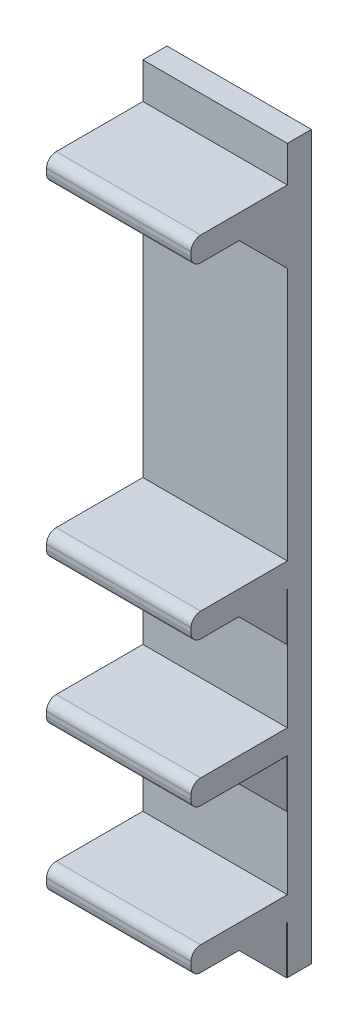
from build123d import *

# Parameters (mm, degrees)
SKETCH1_W           = 19.05
SKETCH1_H           = 95.25
BOSS_EXTRUDE1_DEPTH = 3.175
SKETCH2_W           = 19.05
SKETCH2_H           = 3.175
BOSS_EXTRUDE2_DEPTH = 12.7
BOSS_EXTRUDE3_DEPTH = 19.05
FILLET1_R           = 1.27


with BuildPart() as part:
    # Sketch1 → Boss-Extrude1 (new body)
    with BuildSketch(Plane.XY):
        with Locations((9.525, 47.625)):
            Rectangle(SKETCH1_W, SKETCH1_H)
    extrude(amount=-BOSS_EXTRUDE1_DEPTH)

    # Sketch2 → Boss-Extrude2 (add)
    with BuildSketch(Plane.XY):
        with Locations((9.525, 7.8867)):
            Rectangle(SKETCH2_W, SKETCH2_H)
        with Locations((9.525, 26.9367)):
            Rectangle(SKETCH2_W, SKETCH2_H)
        with Locations((9.525, 45.9867)):
            Rectangle(SKETCH2_W, SKETCH2_H)
        with Locations((9.525, 88.9127)):
            Rectangle(SKETCH2_W, SKETCH2_H)
    extrude(amount=BOSS_EXTRUDE2_DEPTH)

    # Sketch3 → Boss-Extrude3 (add)
    with BuildSketch(Plane(origin=(19.05, 0, 0), x_dir=(0, 0, -1), z_dir=(1, 0, 0))):
        Polygon((0, 87.3252), (-6.35, 87.3252), (0, 80.9752), align=None)
        Polygon((-0.07667178, 44.3992), (-6.401830324, 44.3992), (-0.07667178, 38.074041456), align=None)
        Polygon((-0.038567772, 18.971792462), (-0.038567772, 25.321792462), (-6.388567772, 25.321792462), align=None)
        Polygon((-6.449684868, 6.365000022), (-0.099684868, 0.015000022), (-0.099684868, 6.365000022), align=None)
    extrude(amount=-BOSS_EXTRUDE3_DEPTH)


with BuildPart() as boss_extrude3_piece_1:
    # of the separate pieces the step leaves, piece 1, a body of its own (boss_extrude3_pieces)
    add(part.part.solids().sort_by_distance((0, 0, 0))[0])

    # Fillet1
    fillet1_edges = [boss_extrude3_piece_1.edges().sort_by_distance(p)[0] for p in [
        (9.525, 6.2992, 12.7),
        (9.525, 9.4742, 12.7),
        (9.525, 25.3492, 12.7),
        (9.525, 28.5242, 12.7),
        (9.525, 44.3992, 12.7),
        (9.525, 47.5742, 12.7),
        (9.525, 87.3252, 12.7),
        (9.525, 90.5002, 12.7),
    ]]
    fillet(fillet1_edges, radius=FILLET1_R)


with BuildPart() as boss_extrude3_piece_2:
    # of the separate pieces the step leaves, piece 2, a body of its own (boss_extrude3_pieces)
    add(part.part.solids().sort_by_distance((19.05, 18.971792462, 0.038567772))[0])


solid = Compound([boss_extrude3_piece_1.part, boss_extrude3_piece_2.part])
